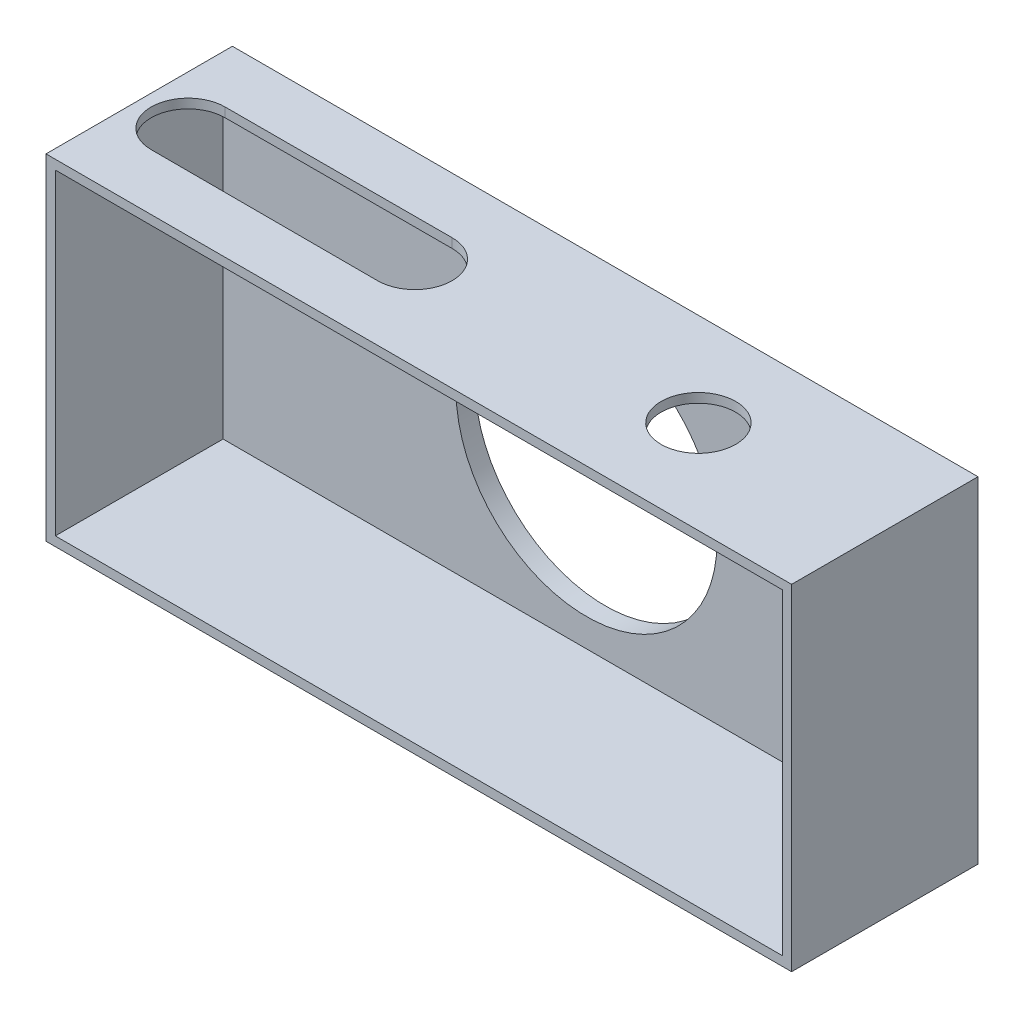
from build123d import *

# Parameters (mm, degrees)
SKETCH1_W           = 508
SKETCH1_H           = 228.6
BOSS_EXTRUDE1_DEPTH = 127
CUT_EXTRUDE1_DEPTH  = 114.3
SKETCH3_R           = 88.9
CUT_EXTRUDE2_DEPTH  = 157.988
SKETCH4_R           = 25.4
CUT_EXTRUDE3_DEPTH  = 157.988


with BuildPart() as part:
    # Sketch1 → Boss-Extrude1 (new body)
    with BuildSketch(Plane.XY):
        with Locations((-254, -114.3)):
            Rectangle(SKETCH1_W, SKETCH1_H)
    extrude(amount=BOSS_EXTRUDE1_DEPTH)

    # Sketch2 → Cut-Extrude1 (cut)
    with BuildSketch(Plane.XY.offset(127)):
        Polygon((-14.111111111, -6.35), (-254, -114.3), (-14.111111111, -222.25), (-6.35, -222.25), (-6.35, -6.35), align=None)
        Polygon((-14.111111111, -6.35), (-493.888888889, -6.35), (-254, -114.3), align=None)
        Polygon((-254, -114.3), (-493.888888889, -6.35), (-501.65, -6.35), (-501.65, -222.25), (-493.888888889, -222.25), align=None)
        Polygon((-14.111111111, -222.25), (-254, -114.3), (-493.888888889, -222.25), align=None)
    extrude(amount=-CUT_EXTRUDE1_DEPTH, mode=Mode.SUBTRACT)

    # Sketch3 → Cut-Extrude2 (cut)
    with BuildSketch(Plane.XY.offset(127)):
        with Locations((-254, -114.3)):
            Circle(SKETCH3_R)
    extrude(amount=-CUT_EXTRUDE2_DEPTH, mode=Mode.SUBTRACT)

    # Sketch4 → Cut-Extrude3 (cut)
    with BuildSketch(Plane(origin=(0, 0, 0), x_dir=(1, 0, 0), z_dir=(0, 1, 0))):
        with BuildLine():
            Line((-320.23493056, -38.112662334), (-474.665471548, -38.314758497))
            ThreePointArc((-474.665471548, -38.314758497), (-499.850713051, -63.5), (-474.665471548, -88.685241503))
            Line((-474.665471548, -88.685241503), (-320.23493056, -88.887337666))
            Line((-320.23493056, -88.887337666), (-320.168483959, -88.887424622))
            ThreePointArc((-320.168483959, -88.887424622), (-294.781059337, -63.5), (-320.168483959, -38.112575378))
            Line((-320.168483959, -38.112575378), (-320.23493056, -38.112662334))
        make_face()
        with Locations(Location((-127, -63.5, 0), (0, 0, 270))):
            Circle(SKETCH4_R)
    extrude(amount=-CUT_EXTRUDE3_DEPTH, mode=Mode.SUBTRACT)


solid = part.part
